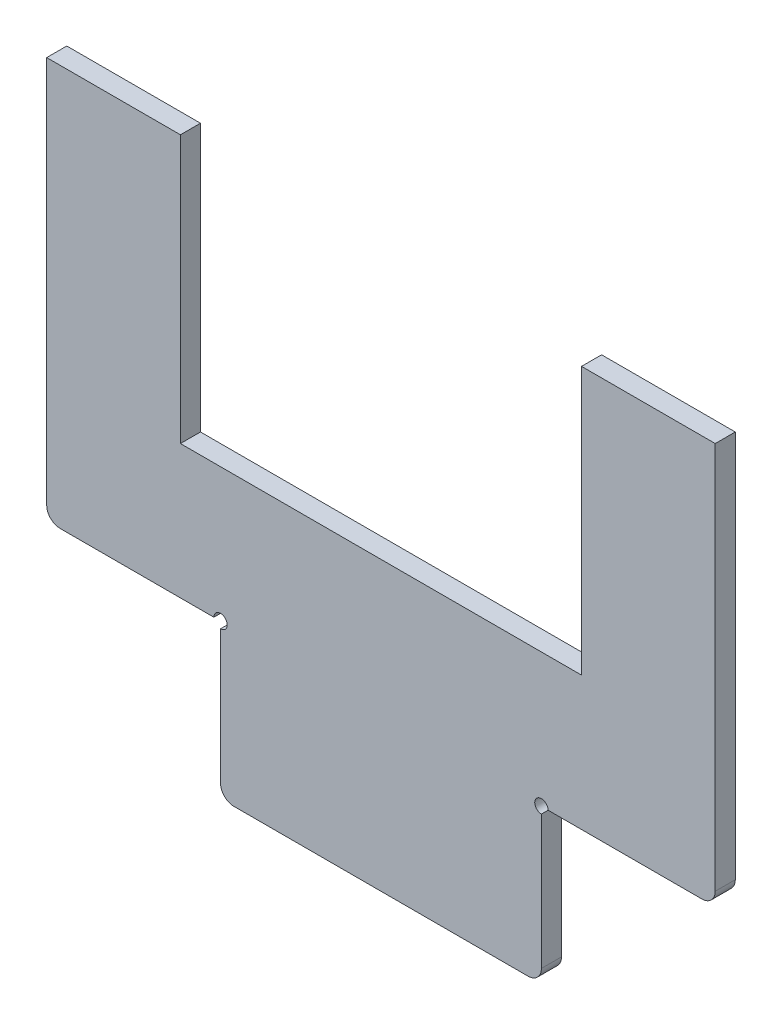
from build123d import *

# Parameters (mm, degrees)
SKETCH1_W           = 48
SKETCH1_H           = 23
BOSS_EXTRUDE1_DEPTH = 3
BOSS_EXTRUDE2_DEPTH = 3
SKETCH3_R           = 1
CUT_EXTRUDE1_DEPTH  = 88.299770905
FILLET1_R           = 2


with BuildPart() as part:
    # Sketch1 → Boss-Extrude1 (new body)
    with BuildSketch(Plane.XY):
        Rectangle(SKETCH1_W, SKETCH1_H)
    extrude(amount=BOSS_EXTRUDE1_DEPTH)

    # Sketch2 → Boss-Extrude2 (add)
    with BuildSketch(Plane.XY.offset(3)):
        Polygon((50, 11.5), (-50, 11.5), (-50, 71.5), (-30, 71.5), (-30, 31.5), (30, 31.5), (30, 71.5), (50, 71.5), align=None)
    extrude(amount=-BOSS_EXTRUDE2_DEPTH)

    # Sketch3 → Cut-Extrude1 (cut, through all)
    with BuildSketch(Plane.XY.offset(3)):
        with Locations((-24, 11.5)):
            Circle(SKETCH3_R)
        with Locations((24, 11.5)):
            Circle(SKETCH3_R)
    extrude(amount=-CUT_EXTRUDE1_DEPTH, mode=Mode.SUBTRACT)

    # Fillet1
    fillet1_edges = [part.edges().sort_by_distance(p)[0] for p in [
        (50, 11.5, 1.5),
        (-50, 11.5, 1.5),
        (24, -11.5, 1.5),
        (-24, -11.5, 1.5),
    ]]
    fillet(fillet1_edges, radius=FILLET1_R)


solid = part.part
